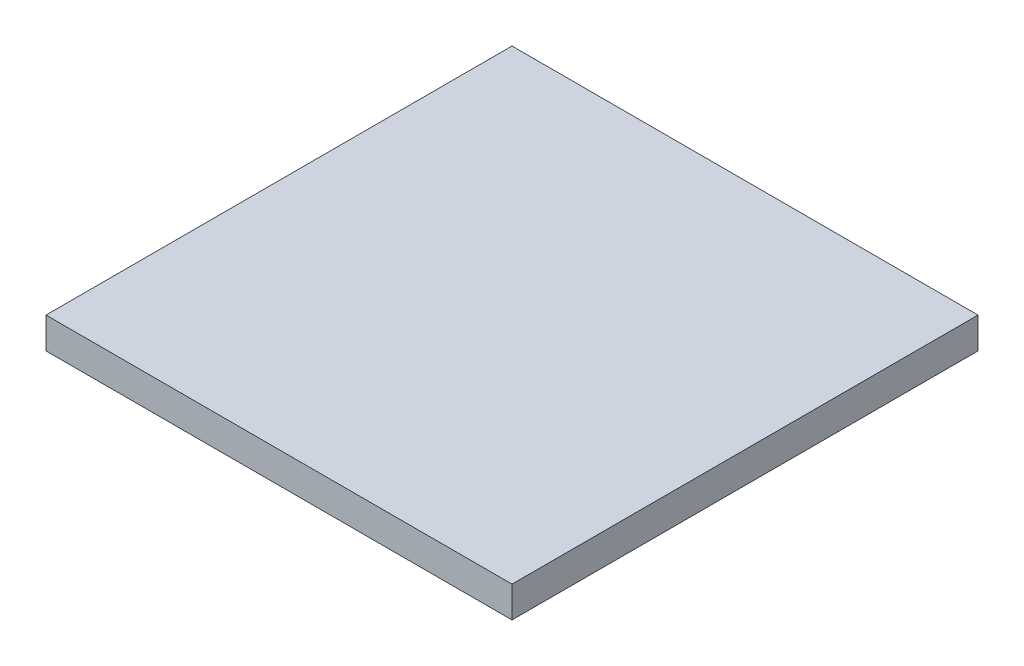
from build123d import *

# Parameters (mm, degrees)
CROQUIS1_W              = 150
CROQUIS1_H              = 150
SALIENTE_EXTRUIR1_DEPTH = 10


with BuildPart() as part:
    # Croquis1 → Saliente-Extruir1 (new body)
    with BuildSketch(Plane(origin=(0, 0, 0), x_dir=(1, 0, 0), z_dir=(0, 1, 0))):
        Rectangle(CROQUIS1_W, CROQUIS1_H)
    extrude(amount=SALIENTE_EXTRUIR1_DEPTH)


solid = part.part
